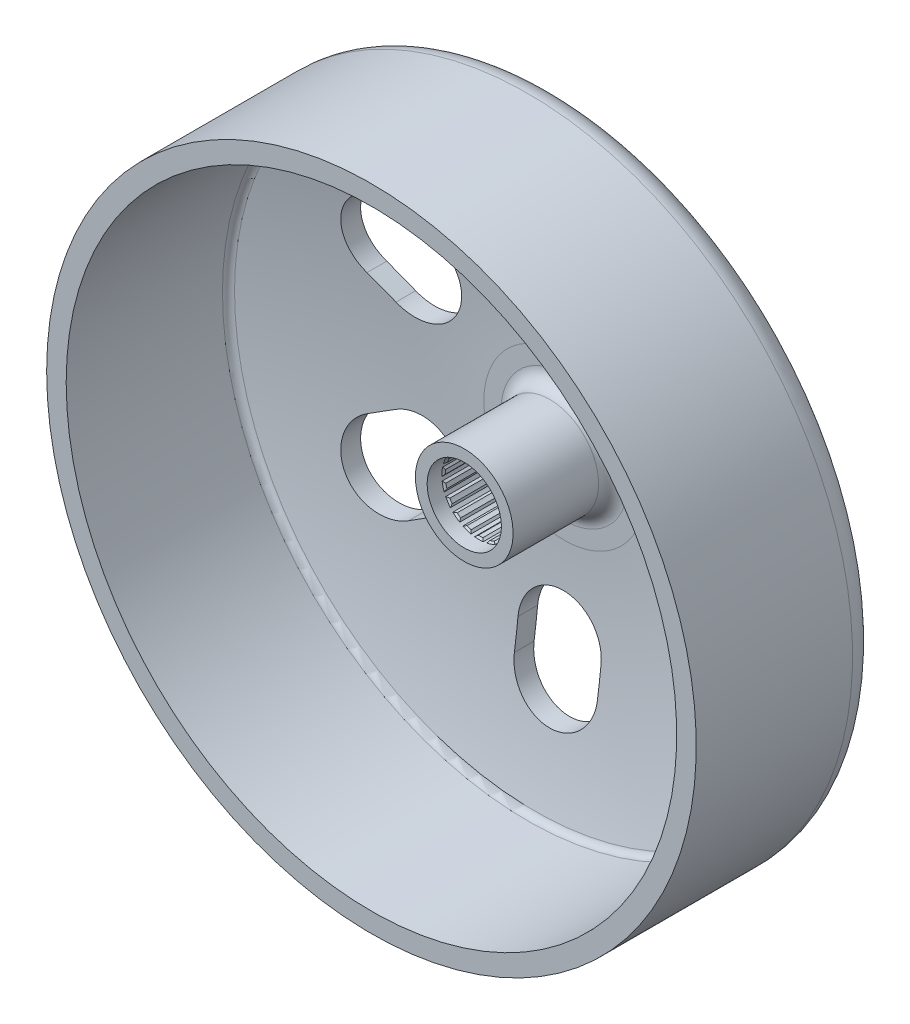
from build123d import *

# Parameters (mm, degrees)
CORTE_EXTRUS_O1_DEPTH      = 104.409380683
CORTE_EXTRUS_O1_DEPTH_BACK = 104.409380683


with BuildPart() as part:
    # Esboço1 → Revolução1 (revolve)
    with BuildSketch(Plane(origin=(0, 0, 0), x_dir=(0, 0, -1), z_dir=(1, 0, 0)), mode=Mode.PRIVATE) as revolu_o1_sk:
        with BuildLine():
            Line((0, 9.5), (-0.602885683, 7.25))
            Line((-0.602885683, 7.25), (-20.65, 7.25))
            Line((-20.65, 7.25), (-21, 7.6))
            Line((-21, 7.6), (-24, 7.6))
            Line((-24, 7.6), (-24, 10))
            Line((-24, 10), (-6.5, 10))
            ThreePointArc((-6.5, 10), (-4.378679656, 10.878679656), (-3.5, 13))
            Line((-3.5, 13), (-3.5, 16.5))
            ThreePointArc((-3.5, 16.5), (-5.031685085, 39.17290561), (-9.598906278, 61.433795048))
            ThreePointArc((-9.598906278, 61.433795048), (-10.119679516, 62.203136996), (-11, 62.5))
            Line((-11, 62.5), (-43, 62.5))
            Line((-43, 62.5), (-43, 66.5))
            Line((-43, 66.5), (-11, 66.5))
            ThreePointArc((-11, 66.5), (-7.697368616, 65.386281652), (-5.743623279, 62.5))
            ThreePointArc((-5.743623279, 62.5), (-1.068029449, 39.710896319), (0.5, 16.5))
            Line((0.5, 16.5), (0.5, 15.5))
            ThreePointArc((0.5, 15.5), (0.125216264, 12.510398645), (0, 9.5))
        make_face()
    revolve(revolu_o1_sk.sketch.rotate(Axis((0, 0, 0), (0, 0, 1)), 90), axis=Axis((0, 0, 0), (0, 0, 1)))

    # Esboço2 → Corte-extrusão1 (cut, two sides: drawn at the far end of the back side and taken through both)
    with BuildSketch(Plane.XY.offset(-CORTE_EXTRUS_O1_DEPTH_BACK)):
        with BuildLine():
            Line((8.5, 39.75), (8.5, 33.75))
            ThreePointArc((8.5, 33.75), (0, 25.25), (-8.5, 33.75))
            Line((-8.5, 33.75), (-8.5, 39.75))
            ThreePointArc((-8.5, 39.75), (0, 48.25), (8.5, 39.75))
        make_face()
        with BuildLine():
            Line((-0.370120339, 7.590982211), (-0.75, 7.211102551))
            ThreePointArc((-0.75, 7.211102551), (0, 7.25), (0.75, 7.211102551))
            Line((0.75, 7.211102551), (0.370120339, 7.590982211))
            ThreePointArc((0.370120339, 7.590982211), (0, 7.6), (-0.370120339, 7.590982211))
        make_face()
        with BuildLine():
            Line((2.114721696, 7.299859735), (1.632078239, 7.063909726))
            ThreePointArc((1.632078239, 7.063909726), (2.354071152, 6.857175002), (3.050804102, 6.576860522))
            Line((3.050804102, 6.576860522), (2.814854093, 7.059503979))
            ThreePointArc((2.814854093, 7.059503979), (2.467715966, 7.188211037), (2.114721696, 7.299859735))
        make_face()
        with BuildLine():
            Line((4.370400823, 6.217684187), (3.837295477, 6.151232675))
            ThreePointArc((3.837295477, 6.151232675), (4.453042167, 5.721268693), (5.021006241, 5.229913606))
            Line((5.021006241, 5.229913606), (4.954554729, 5.763018951))
            ThreePointArc((4.954554729, 5.763018951), (4.668016616, 5.997467871), (4.370400823, 6.217684187))
        make_face()
        with BuildLine():
            Line((6.152479207, 4.46172608), (5.626682208, 4.571974117))
            ThreePointArc((5.626682208, 4.571974117), (6.069456967, 3.965374146), (6.447104446, 3.3162244))
            Line((6.447104446, 3.3162244), (6.557352482, 3.842021398))
            ThreePointArc((6.557352482, 3.842021398), (6.362465235, 4.156806002), (6.152479207, 4.46172608))
        make_face()
        with BuildLine():
            Line((7.267841003, 2.222270722), (6.806330615, 2.497271222))
            ThreePointArc((6.806330615, 2.497271222), (7.028151928, 1.779769782), (7.174558846, 1.043170823))
            Line((7.174558846, 1.043170823), (7.449559346, 1.504681211))
            ThreePointArc((7.449559346, 1.504681211), (7.367442021, 1.865689702), (7.267841003, 2.222270722))
        make_face()
        with BuildLine():
            Line((7.595619454, -0.258002152), (7.248407489, 0.151950241))
            ThreePointArc((7.248407489, 0.151950241), (7.225237574, -0.598700255), (7.124538471, -1.342926499))
            Line((7.124538471, -1.342926499), (7.534490863, -0.995714533))
            ThreePointArc((7.534490863, -0.995714533), (7.574042147, -0.627603026), (7.595619454, -0.258002152))
        make_face()
        with BuildLine():
            Line((7.100294679, -2.710316488), (6.90500694, -2.209836906))
            ThreePointArc((6.90500694, -2.209836906), (6.639356618, -2.912291829), (6.302463803, -3.583496896))
            Line((6.302463803, -3.583496896), (6.802943385, -3.388209158))
            ThreePointArc((6.802943385, -3.388209158), (6.959877283, -3.052885227), (7.100294679, -2.710316488))
        make_face()
        with BuildLine():
            Line((5.835542804, -4.868925979), (5.813341748, -4.332153936))
            ThreePointArc((5.813341748, -4.332153936), (5.333998352, -4.910291394), (4.79741939, -5.435739802))
            Line((4.79741939, -5.435739802), (5.334191433, -5.413538746))
            ThreePointArc((5.334191433, -5.413538746), (5.591501721, -5.147339944), (5.835542804, -4.868925979))
        make_face()
        with BuildLine():
            Line((3.938419317, -6.49991179), (4.091710773, -5.985014866))
            ThreePointArc((4.091710773, -5.985014866), (3.4506186, -6.376184696), (2.772500147, -6.698935956))
            Line((2.772500147, -6.698935956), (3.287397071, -6.852227412))
            ThreePointArc((3.287397071, -6.852227412), (3.617200187, -6.684000509), (3.938419317, -6.49991179))
        make_face()
        with BuildLine():
            Line((1.614506987, -7.426531303), (1.926679447, -6.989306568))
            ThreePointArc((1.926679447, -6.989306568), (1.19331078, -7.15111945), (0.447137492, -7.236198454))
            Line((0.447137492, -7.236198454), (0.884362226, -7.548370914))
            ThreePointArc((0.884362226, -7.548370914), (1.250918886, -7.496345906), (1.614506987, -7.426531303))
        make_face()
        with BuildLine():
            Line((-0.884362226, -7.548370914), (-0.447137492, -7.236198454))
            ThreePointArc((-0.447137492, -7.236198454), (-1.19331078, -7.15111945), (-1.926679447, -6.989306568))
            Line((-1.926679447, -6.989306568), (-1.614506987, -7.426531303))
            ThreePointArc((-1.614506987, -7.426531303), (-1.250918886, -7.496345906), (-0.884362226, -7.548370914))
        make_face()
        with BuildLine():
            Line((-3.287397071, -6.852227412), (-2.772500147, -6.698935956))
            ThreePointArc((-2.772500147, -6.698935956), (-3.4506186, -6.376184696), (-4.091710773, -5.985014866))
            Line((-4.091710773, -5.985014866), (-3.938419317, -6.49991179))
            ThreePointArc((-3.938419317, -6.49991179), (-3.617200187, -6.684000509), (-3.287397071, -6.852227412))
        make_face()
        with BuildLine():
            Line((-5.334191433, -5.413538746), (-4.79741939, -5.435739802))
            ThreePointArc((-4.79741939, -5.435739802), (-5.333998352, -4.910291394), (-5.813341748, -4.332153936))
            Line((-5.813341748, -4.332153936), (-5.835542804, -4.868925979))
            ThreePointArc((-5.835542804, -4.868925979), (-5.591501721, -5.147339944), (-5.334191433, -5.413538746))
        make_face()
        with BuildLine():
            Line((-6.802943385, -3.388209158), (-6.302463803, -3.583496896))
            ThreePointArc((-6.302463803, -3.583496896), (-6.639356618, -2.912291829), (-6.90500694, -2.209836906))
            Line((-6.90500694, -2.209836906), (-7.100294679, -2.710316488))
            ThreePointArc((-7.100294679, -2.710316488), (-6.959877283, -3.052885227), (-6.802943385, -3.388209158))
        make_face()
        with BuildLine():
            Line((-7.534490863, -0.995714533), (-7.124538471, -1.342926499))
            ThreePointArc((-7.124538471, -1.342926499), (-7.225237574, -0.598700255), (-7.248407489, 0.151950241))
            Line((-7.248407489, 0.151950241), (-7.595619454, -0.258002152))
            ThreePointArc((-7.595619454, -0.258002152), (-7.574042147, -0.627603026), (-7.534490863, -0.995714533))
        make_face()
        with BuildLine():
            Line((-7.449559346, 1.504681211), (-7.174558846, 1.043170823))
            ThreePointArc((-7.174558846, 1.043170823), (-7.028151928, 1.779769782), (-6.806330615, 2.497271222))
            Line((-6.806330615, 2.497271222), (-7.267841003, 2.222270722))
            ThreePointArc((-7.267841003, 2.222270722), (-7.367442021, 1.865689702), (-7.449559346, 1.504681211))
        make_face()
        with BuildLine():
            Line((-6.557352482, 3.842021398), (-6.447104446, 3.3162244))
            ThreePointArc((-6.447104446, 3.3162244), (-6.069456967, 3.965374146), (-5.626682208, 4.571974117))
            Line((-5.626682208, 4.571974117), (-6.152479207, 4.46172608))
            ThreePointArc((-6.152479207, 4.46172608), (-6.362465235, 4.156806002), (-6.557352482, 3.842021398))
        make_face()
        with BuildLine():
            Line((-4.954554729, 5.763018951), (-5.021006241, 5.229913606))
            ThreePointArc((-5.021006241, 5.229913606), (-4.453042167, 5.721268693), (-3.837295477, 6.151232675))
            Line((-3.837295477, 6.151232675), (-4.370400823, 6.217684187))
            ThreePointArc((-4.370400823, 6.217684187), (-4.668016616, 5.997467871), (-4.954554729, 5.763018951))
        make_face()
        with BuildLine():
            Line((-2.814854093, 7.059503979), (-3.050804102, 6.576860522))
            ThreePointArc((-3.050804102, 6.576860522), (-2.354071152, 6.857175002), (-1.632078239, 7.063909726))
            Line((-1.632078239, 7.063909726), (-2.114721696, 7.299859735))
            ThreePointArc((-2.114721696, 7.299859735), (-2.467715966, 7.188211037), (-2.814854093, 7.059503979))
        make_face()
        with BuildLine():
            Line((38.6745098, 12.513784068), (33.478357378, 9.513784068))
            ThreePointArc((33.478357378, 9.513784068), (21.867141446, 12.625), (24.978357378, 24.236215932))
            Line((24.978357378, 24.236215932), (30.1745098, 27.236215932))
            ThreePointArc((30.1745098, 27.236215932), (41.785725733, 24.125), (38.6745098, 12.513784068))
        make_face()
        with BuildLine():
            Line((30.1745098, -27.236215932), (24.978357378, -24.236215932))
            ThreePointArc((24.978357378, -24.236215932), (21.867141446, -12.625), (33.478357378, -9.513784068))
            Line((33.478357378, -9.513784068), (38.6745098, -12.513784068))
            ThreePointArc((38.6745098, -12.513784068), (41.785725733, -24.125), (30.1745098, -27.236215932))
        make_face()
        with BuildLine():
            Line((-8.5, -39.75), (-8.5, -33.75))
            ThreePointArc((-8.5, -33.75), (0, -25.25), (8.5, -33.75))
            Line((8.5, -33.75), (8.5, -39.75))
            ThreePointArc((8.5, -39.75), (0, -48.25), (-8.5, -39.75))
        make_face()
        with BuildLine():
            Line((-38.6745098, -12.513784068), (-33.478357378, -9.513784068))
            ThreePointArc((-33.478357378, -9.513784068), (-21.867141446, -12.625), (-24.978357378, -24.236215932))
            Line((-24.978357378, -24.236215932), (-30.1745098, -27.236215932))
            ThreePointArc((-30.1745098, -27.236215932), (-41.785725733, -24.125), (-38.6745098, -12.513784068))
        make_face()
        with BuildLine():
            Line((-30.1745098, 27.236215932), (-24.978357378, 24.236215932))
            ThreePointArc((-24.978357378, 24.236215932), (-21.867141446, 12.625), (-33.478357378, 9.513784068))
            Line((-33.478357378, 9.513784068), (-38.6745098, 12.513784068))
            ThreePointArc((-38.6745098, 12.513784068), (-41.785725733, 24.125), (-30.1745098, 27.236215932))
        make_face()
    extrude(amount=CORTE_EXTRUS_O1_DEPTH + CORTE_EXTRUS_O1_DEPTH_BACK, mode=Mode.SUBTRACT)


solid = part.part
